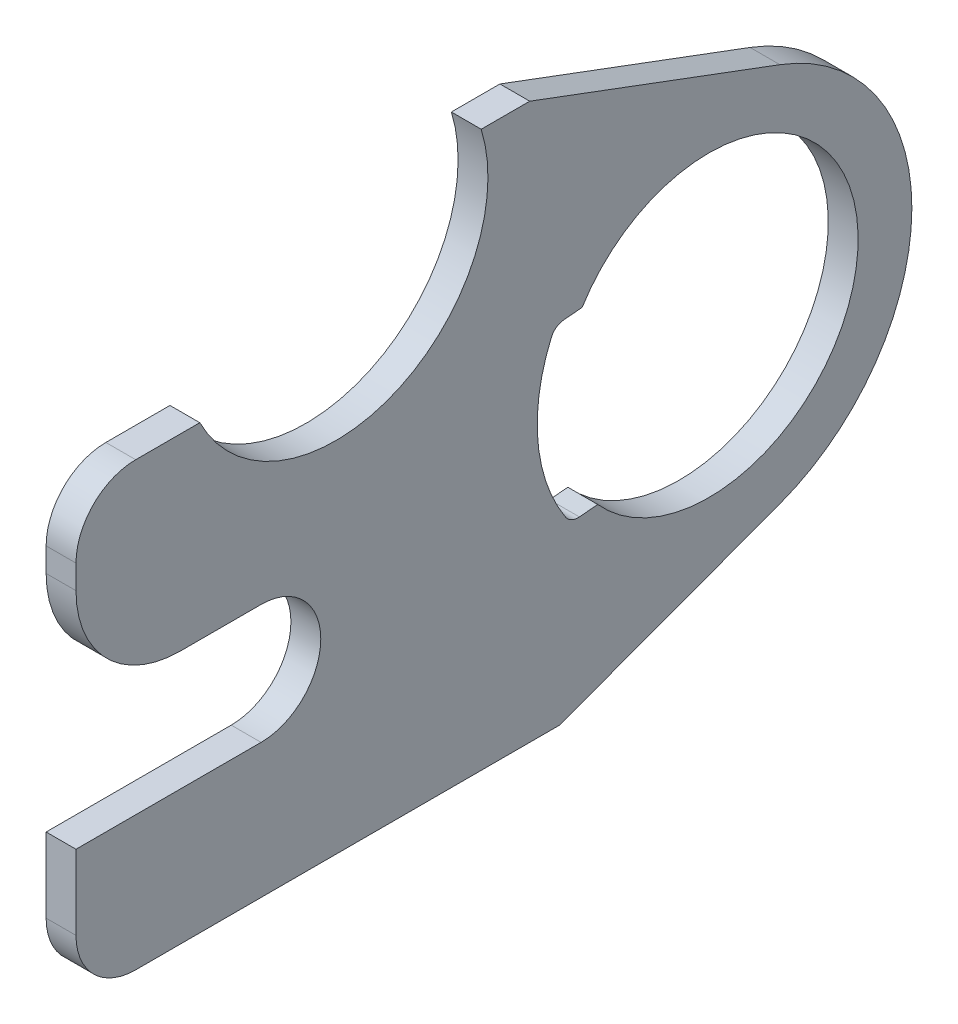
from build123d import *

# Parameters (mm, degrees)
SKETCH_1_R          = 50
EXTRUDE_1_DEPTH     = 10
FILLET_1_R          = 20
FILLET_2_R          = 35
CUT_EXTRUDE_START   = -12
CUT_EXTRUDE_1_DEPTH = 12
FILLET_3_R          = 5


with BuildPart() as part:
    # 草图1 → 凸台-拉伸1 (new body)
    with BuildSketch(Plane(origin=(0, 0, 0), x_dir=(0, 0, -1), z_dir=(1, 0, 0))):
        with BuildLine():
            Line((-212, -91), (-50, -91))
            Line((-50, -91), (23.592526884, -63.776113673))
            ThreePointArc((23.592526884, -63.776113673), (67.999915285, -0.107337145), (23.793748654, 63.701314939))
            Line((23.793748654, 63.701314939), (-60, 95))
            Line((-60, 95), (-76.255769572, 95))
            ThreePointArc((-76.255769572, 95), (-105.931697447, 32.698838939), (-170.519226707, 57))
            Line((-170.519226707, 57), (-212, 57))
            Line((-212, 57), (-212, -6))
            Line((-212, -6), (-150, -6))
            ThreePointArc((-150, -6), (-130, -26), (-150, -46))
            Line((-150, -46), (-212, -46))
            Line((-212, -46), (-212, -91))
        make_face()
        Circle(SKETCH_1_R, mode=Mode.SUBTRACT)
    extrude(amount=EXTRUDE_1_DEPTH)

    # 圆角1
    fillet_1_edges = [part.edges().sort_by_distance(p)[0] for p in [
        (5, 57, 212),
        (5, -91, 212),
    ]]
    fillet(fillet_1_edges, radius=FILLET_1_R)

    # 圆角2
    fillet_2_edges = [part.edges().sort_by_distance(p)[0] for p in [
        (5, -6, 212),
    ]]
    fillet(fillet_2_edges, radius=FILLET_2_R)

    # 草图2 → 切除-拉伸1 (cut)
    with BuildSketch(Plane(origin=(10, 0, 0), x_dir=(0, 0, -1), z_dir=(1, 0, 0)).offset(CUT_EXTRUDE_START)):
        with BuildLine():
            Line((-42.462460206, 26.399611233), (-51.481550921, 25.61054304))
            ThreePointArc((-51.481550921, 25.61054304), (-57.28119514, -5.011455208), (-46.252206356, -34.161138845))
            Line((-46.252206356, -34.161138845), (-37.233115641, -33.372070653))
            ThreePointArc((-37.233115641, -33.372070653), (-49.809734905, -4.357787137), (-42.462460206, 26.399611233))
        make_face()
    extrude(amount=CUT_EXTRUDE_1_DEPTH, mode=Mode.SUBTRACT)

    # 圆角3
    fillet_3_edges = [part.edges().sort_by_distance(p)[0] for p in [
        (5, -34.161138845, 46.252206356),
        (5, 25.61054304, 51.481550921),
    ]]
    fillet(fillet_3_edges, radius=FILLET_3_R)


solid = part.part
